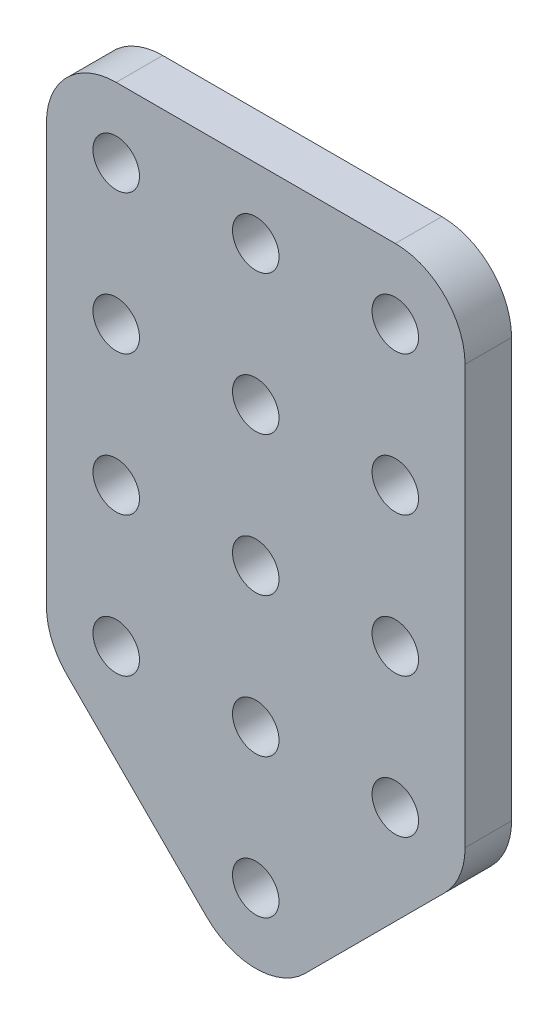
from build123d import *

# Parameters (mm, degrees)
MODEL_R                 = 1.5
SALIENTE_EXTRUIR1_DEPTH = 3


with BuildPart() as part:
    # Model → Saliente-Extruir1 (new body)
    with BuildSketch(Plane.XY):
        with BuildLine():
            Line((174.227054575, 213.178720063), (174.227054575, 204.178720063))
            ThreePointArc((174.227054575, 204.178720063), (174.569596678, 202.456644617), (175.545074059, 200.996739548))
            Line((175.545074059, 200.996739548), (184.545074059, 191.996739548))
            ThreePointArc((184.545074059, 191.996739548), (187.727054575, 190.678720063), (190.90903509, 191.996739548))
            Line((190.90903509, 191.996739548), (199.90903509, 200.996739548))
            ThreePointArc((199.90903509, 200.996739548), (200.884512471, 202.456644617), (201.227054575, 204.178720063))
            Line((201.227054575, 204.178720063), (201.227054575, 231.178720063))
            ThreePointArc((201.227054575, 231.178720063), (199.90903509, 234.360700578), (196.727054575, 235.678720063))
            Line((196.727054575, 235.678720063), (178.727054575, 235.678720063))
            ThreePointArc((178.727054575, 235.678720063), (175.545074059, 234.360700578), (174.227054575, 231.178720063))
            Line((174.227054575, 231.178720063), (174.227054575, 213.178720063))
        make_face()
        with Locations((187.727054575, 204.178720063)):
            Circle(MODEL_R, mode=Mode.SUBTRACT)
        with Locations((178.727054575, 204.178720063)):
            Circle(MODEL_R, mode=Mode.SUBTRACT)
        with Locations((187.727054575, 213.178720063)):
            Circle(MODEL_R, mode=Mode.SUBTRACT)
        with Locations((178.727054575, 213.178720063)):
            Circle(MODEL_R, mode=Mode.SUBTRACT)
        with Locations((196.727054575, 213.178720063)):
            Circle(MODEL_R, mode=Mode.SUBTRACT)
        with Locations((187.727054575, 195.178720063)):
            Circle(MODEL_R, mode=Mode.SUBTRACT)
        with Locations((196.727054575, 204.178720063)):
            Circle(MODEL_R, mode=Mode.SUBTRACT)
        with Locations((187.727054575, 222.178720063)):
            Circle(MODEL_R, mode=Mode.SUBTRACT)
        with Locations((178.727054575, 222.178720063)):
            Circle(MODEL_R, mode=Mode.SUBTRACT)
        with Locations((196.727054575, 222.178720063)):
            Circle(MODEL_R, mode=Mode.SUBTRACT)
        with Locations((187.727054575, 231.178720063)):
            Circle(MODEL_R, mode=Mode.SUBTRACT)
        with Locations((178.727054575, 231.178720063)):
            Circle(MODEL_R, mode=Mode.SUBTRACT)
        with Locations((196.727054575, 231.178720063)):
            Circle(MODEL_R, mode=Mode.SUBTRACT)
    extrude(amount=SALIENTE_EXTRUIR1_DEPTH)


solid = part.part
